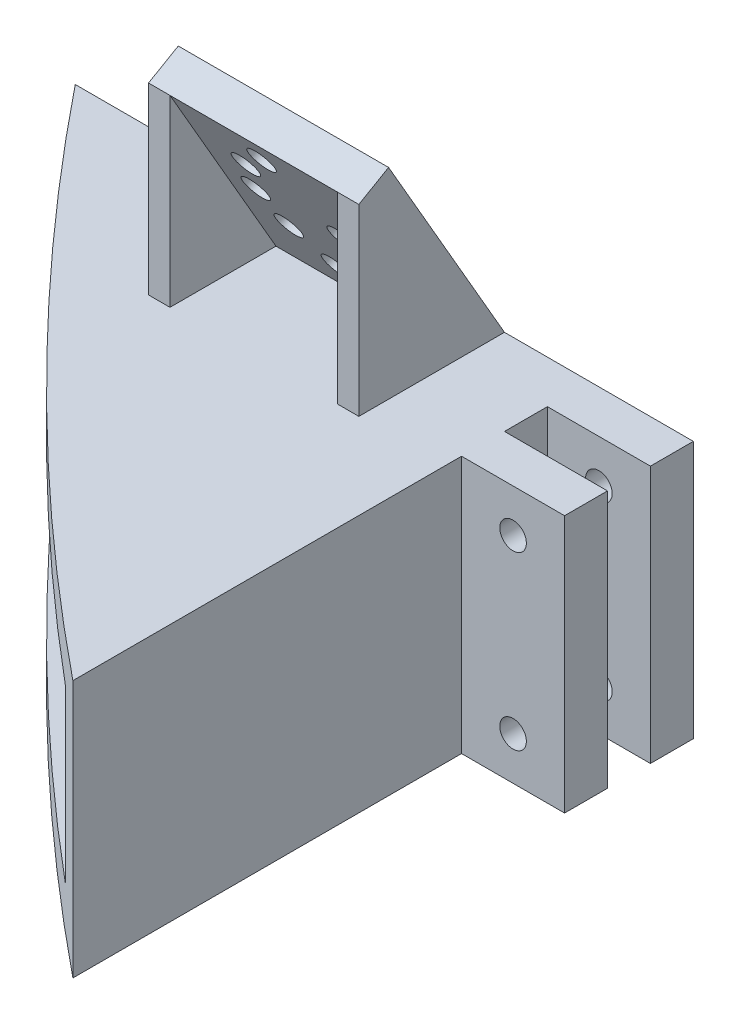
from build123d import *

# Parameters (mm, degrees)
EXTRUDE_1_DEPTH          = 30
CUT_EXTRUDE_1_DEPTH      = 98.124713642
CUT_EXTRUDE_1_DEPTH_BACK = 98.124713642
SKETCH_2_R               = 1.55
CUT_EXTRUDE_6_DEPTH      = 10
EXTRUDE_3_DEPTH          = 12.5
SKETCH_12_W              = 5
SKETCH_12_H              = 30
EXTRUDE_4_DEPTH          = 2
SKETCH_14_W              = 22
SKETCH_14_H              = 27
SKETCH_14_R              = 1.55
EXTRUDE_5_DEPTH          = 4
EXTRUDE_8_DEPTH          = 2.5
EXTRUDE_9_DEPTH          = 2.5


with BuildPart() as part:
    # 草图1 → 凸台-拉伸1 (new body)
    with BuildSketch(Plane(origin=(0, 0, 0), x_dir=(1, 0, 0), z_dir=(0, 1, 0))):
        with BuildLine():
            Line((0, 0), (-70, 0))
            ThreePointArc((-70, 0), (-41.606545869, -31.737243891), (-10, -60.276114672))
            Line((-10, -60.276114672), (-10, -15))
            Line((-10, -15), (0, -15))
            Line((0, -15), (0, -10))
            Line((0, -10), (-10, -10))
            Line((-10, -10), (-10, -5))
            Line((-10, -5), (0, -5))
            Line((0, -5), (0, 0))
        make_face()
    extrude(amount=EXTRUDE_1_DEPTH)

    # 草图2 → 切除-拉伸1 (cut, two sides: drawn at the far end of the back side and taken through both)
    with BuildSketch(Plane(origin=(0, 0, 0), x_dir=(-1, 0, 0), z_dir=(0, 0, -1)).offset(-CUT_EXTRUDE_1_DEPTH_BACK)):
        with Locations((4, 25)):
            Circle(SKETCH_2_R)
        with Locations((4, 5)):
            Circle(SKETCH_2_R)
    extrude(amount=CUT_EXTRUDE_1_DEPTH + CUT_EXTRUDE_1_DEPTH_BACK, mode=Mode.SUBTRACT)

    # 草图9 → 切除-拉伸6 (cut, symmetric)
    with BuildSketch(Plane(origin=(0, 15, 0), x_dir=(1, 0, 0), z_dir=(0, 1, 0))):
        with BuildLine():
            Line((-65.918016471, -5), (-59.391772218, -5))
            Line((-59.391772218, -5), (-15, -5))
            Line((-15, -5), (-15, -15))
            Line((-15, -15), (-15, -49.60330608))
            Line((-15, -49.60330608), (-15, -56.155472209))
            ThreePointArc((-15, -56.155472209), (-41.615194331, -31.728555364), (-65.918016471, -5))
        make_face()
    extrude(amount=CUT_EXTRUDE_6_DEPTH, both=True, mode=Mode.SUBTRACT)

    # 草图11 → 凸台-拉伸3 (add, symmetric)
    with BuildSketch(Plane(origin=(0, 15, 0), x_dir=(1, 0, 0), z_dir=(0, 1, 0))):
        Polygon((-15, -5), (-23, -5), (-15, -10), align=None)
    extrude(amount=EXTRUDE_3_DEPTH, both=True)

    # 草图12 → 凸台-拉伸4 (add)
    with BuildSketch(Plane(origin=(0, 0, 0), x_dir=(0, 0, -1), z_dir=(1, 0, 0))):
        with Locations((-12.5, 15)):
            Rectangle(SKETCH_12_W, SKETCH_12_H)
        with Locations((-2.5, 15)):
            Rectangle(SKETCH_12_W, SKETCH_12_H)
    extrude(amount=EXTRUDE_4_DEPTH)

    # 草图14 → 凸台-拉伸5 (add)
    with BuildSketch(Plane(origin=(0, 7.5, -12.990381057), x_dir=(-1, 0, 0), z_dir=(0, 0.499999999999998, -0.8660254037844398))):
        with Locations((31, 39.480762114)):
            Rectangle(SKETCH_14_W, SKETCH_14_H)
        with Locations(Location((28, 40.980762114, 0), (0, 0, 90))):
            Circle(SKETCH_14_R, mode=Mode.SUBTRACT)
        with Locations(Location((33, 49.641016151, 0), (0, 0, 90))):
            Circle(SKETCH_14_R, mode=Mode.SUBTRACT)
        with Locations(Location((36.660254038, 45.980762114, 0), (0, 0, 90))):
            Circle(SKETCH_14_R, mode=Mode.SUBTRACT)
        with Locations(Location((38, 40.980762114, 0), (0, 0, 90))):
            Circle(SKETCH_14_R, mode=Mode.SUBTRACT)
        with Locations(Location((36.660254038, 35.980762114, 0), (0, 0, 90))):
            Circle(SKETCH_14_R, mode=Mode.SUBTRACT)
        with Locations(Location((33, 32.320508076, 0), (0, 0, 90))):
            Circle(SKETCH_14_R, mode=Mode.SUBTRACT)
    extrude(amount=-EXTRUDE_5_DEPTH)

    # 草图18 → 凸台-拉伸8 (add)
    with BuildSketch(Plane(origin=(-20, 0, 0), x_dir=(0, 0, -1), z_dir=(1, 0, 0))):
        Polygon((-16.964101615, 51.382685902), (-4.618802154, 30), (-16.964101615, 30), align=None)
    extrude(amount=-EXTRUDE_8_DEPTH)

    # 草图19 → 凸台-拉伸9 (add)
    with BuildSketch(Plane.ZY.offset(42)):
        Polygon((0, 30), (13.5, 53.382685902), (16.964101615, 51.382685902), (16.964101615, 30), align=None)
    extrude(amount=EXTRUDE_9_DEPTH)


solid = part.part
